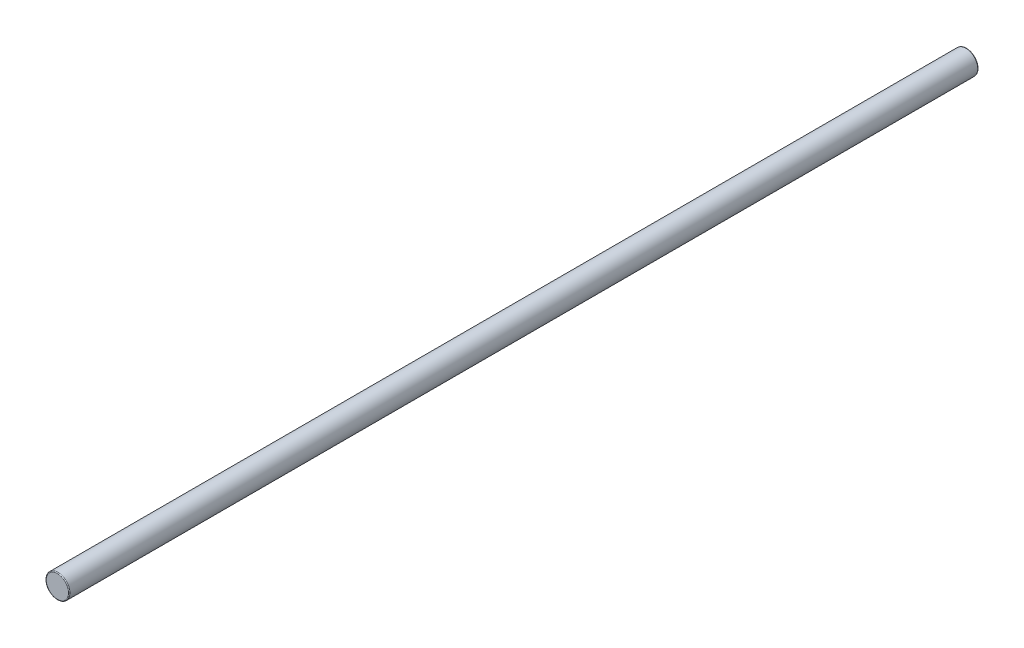
from build123d import *

# Parameters (mm, degrees)
SKETCH1_R           = 3
BOSS_EXTRUDE1_DEPTH = 230
FILLET1_R           = 0.2


with BuildPart() as part:
    # Sketch1 → Boss-Extrude1 (new body)
    with BuildSketch(Plane.XY):
        Circle(SKETCH1_R)
    extrude(amount=-BOSS_EXTRUDE1_DEPTH)

    # Fillet1
    fillet1_edges = [part.edges().sort_by_distance(p)[0] for p in [
        (-3, 0, 0),
        (-3, 0, -230),
    ]]
    fillet(fillet1_edges, radius=FILLET1_R)


solid = part.part
